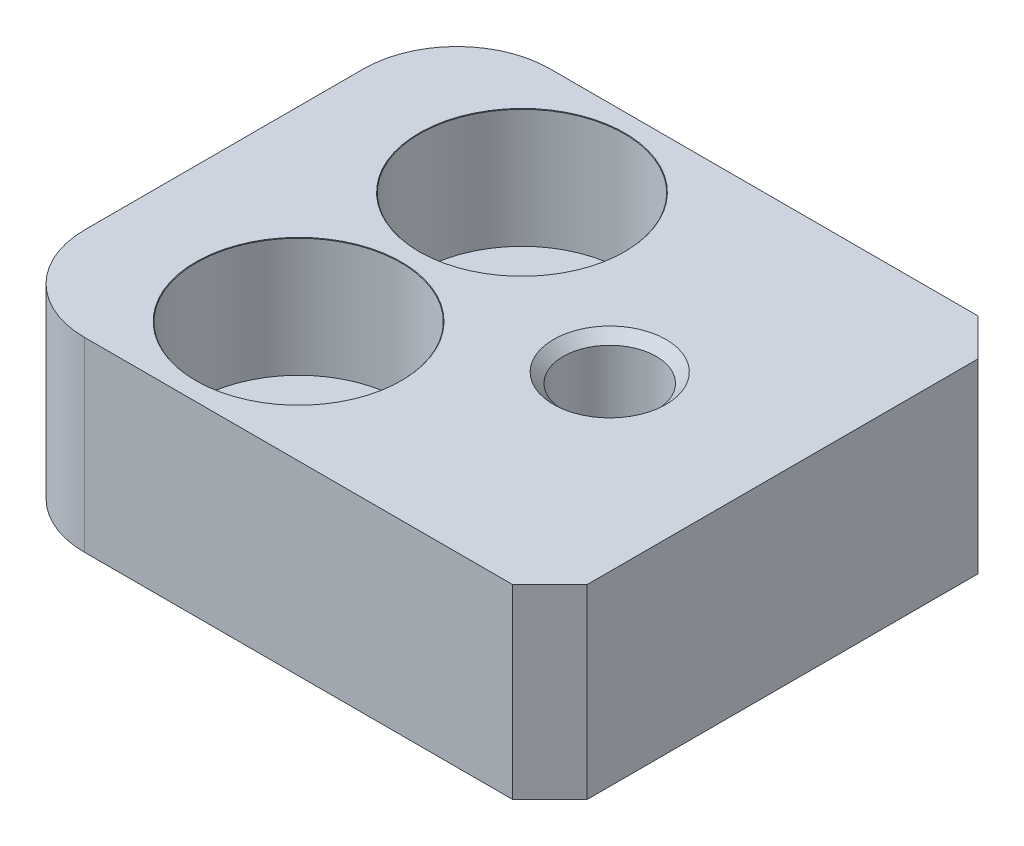
from build123d import *

# Parameters (mm, degrees)
SKETCH1_W                                    = 30
SKETCH1_H                                    = 25
BOSS_EXTRUDE1_DEPTH                          = 10
FILLET1_R                                    = 5
CBORE_FOR_M6_HEX_SOCKET_HEAD_CAP_SCR_2_COUNT = 2
CBORE_FOR_M6_HEX_SOCKET_HEAD_CAP_SCR_2_PITCH = 12
CHAMFER1_SIZE                                = 2


with BuildPart() as part:
    # Sketch1 → Boss-Extrude1 (new body)
    with BuildSketch(Plane(origin=(0, 0, 0), x_dir=(1, 0, 0), z_dir=(0, 1, 0))):
        Rectangle(SKETCH1_W, SKETCH1_H)
    extrude(amount=BOSS_EXTRUDE1_DEPTH)

    # Fillet1
    fillet1_edges = [part.edges().sort_by_distance(p)[0] for p in [
        (-15, 5, -12.5),
        (-15, 5, 12.5),
    ]]
    fillet(fillet1_edges, radius=FILLET1_R)

    # Sketch3 → CBORE for M6 Hex Socket Head Cap Screw1 (revolve, cut)
    with BuildSketch(Plane(origin=(-5, 10, -6), x_dir=(0, 0, 1), z_dir=(1, 0, 0))):
        Polygon((0, 0), (0, 10), (3.325, 10), (3.3, 9.975), (3.3, 6.4), (5.5, 6.4), (5.5, 0.025), (5.525, 0), align=None)
    cbore_for_m6_hex_socket_head_cap_screw1 = revolve(axis=Axis((-5, 16.35, -6), (0, -1, 0)), mode=Mode.SUBTRACT)

    # CBORE for M6 Hex Socket Head Cap Scr 2: CBORE for M6 Hex Socket Head Cap Screw1 ×2
    with Locations(*[(0, 0, i * CBORE_FOR_M6_HEX_SOCKET_HEAD_CAP_SCR_2_PITCH) for i in range(1, CBORE_FOR_M6_HEX_SOCKET_HEAD_CAP_SCR_2_COUNT)]):
        add(cbore_for_m6_hex_socket_head_cap_screw1, mode=Mode.SUBTRACT)

    # Sketch5 → M6 Tapped Hole1 (revolve, cut)
    with BuildSketch(Plane(origin=(5.715161352, 0, 0), x_dir=(0, 0, -1), z_dir=(1, 0, 0))):
        Polygon((0, 0), (0, 10), (3.025, 10), (2.5, 9.475), (2.5, 0.525), (3.025, 0), align=None)
    revolve(axis=Axis((5.715161352, -6.35, 0), (0, 1, 0)), mode=Mode.SUBTRACT)

    # Chamfer1
    chamfer1_edges = [part.edges().sort_by_distance(p)[0] for p in [
        (15, 5, -12.5),
        (15, 5, 12.5),
    ]]
    chamfer(chamfer1_edges, length=CHAMFER1_SIZE)


solid = part.part
